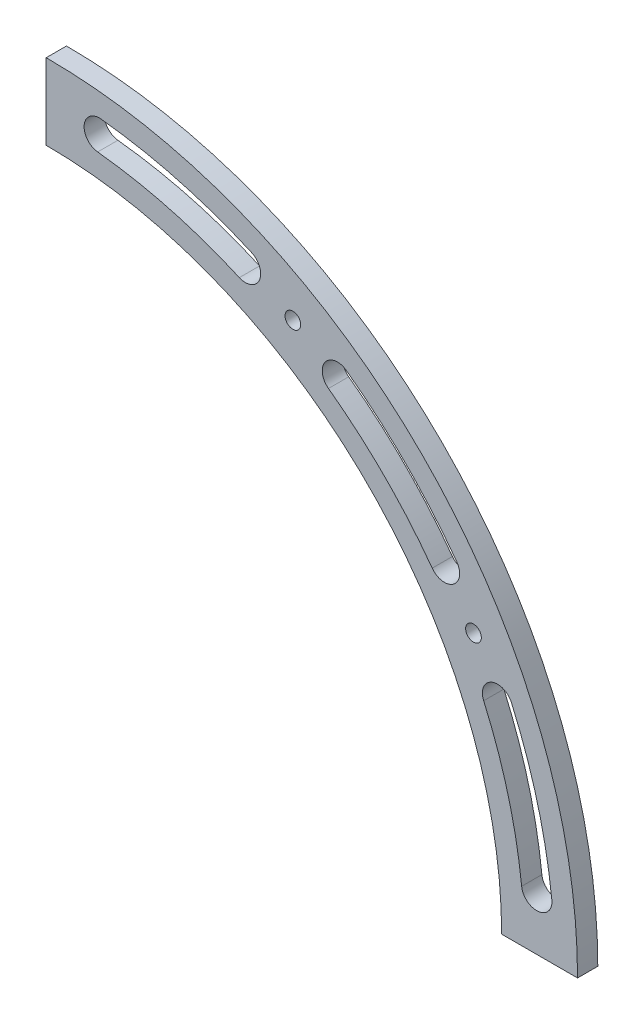
from build123d import *

# Parameters (mm, degrees)
EXTRUDE_1_DEPTH     = 15
SKETCH_2_W          = 15
SKETCH_2_H          = 15
EXTRUDE_2_DEPTH     = 5
EXTRUDE_3_DEPTH     = 15
SKETCH_4_R          = 1.55
CUT_EXTRUDE_1_DEPTH = 163.095650774
SKETCH_5_R          = 1.55
CUT_EXTRUDE_2_DEPTH = 157.68439616
CUT_EXTRUDE_3_DEPTH = 4
SKETCH_7_OUTSIDE_W  = 149.836
SKETCH_7_OUTSIDE_H  = 219.836
CUT_EXTRUDE_4_DEPTH = 163.095650774
CUT_EXTRUDE_START   = -11
CUT_EXTRUDE_5_DEPTH = 11


with BuildPart() as part:
    # 草图1 → 凸台-拉伸1 (new body)
    with BuildSketch(Plane.XY):
        with BuildLine():
            Line((90, 0), (105, 0))
            ThreePointArc((105, 0), (74.246212025, 74.246212025), (0, 105))
            Line((0, 105), (0, 90))
            ThreePointArc((0, 90), (63.639610307, 63.639610307), (90, 0))
        make_face()
    extrude(amount=EXTRUDE_1_DEPTH)

    # 草图2 → 凸台-拉伸2 (add)
    with BuildSketch(Plane.XZ):
        with Locations((97.5, 7.5)):
            Rectangle(SKETCH_2_W, SKETCH_2_H)
    extrude(amount=EXTRUDE_2_DEPTH)

    # 草图3 → 凸台-拉伸3 (add)
    with BuildSketch(Plane(origin=(105, 0, 0), x_dir=(0, 0, -1), z_dir=(1, 0, 0))):
        with BuildLine():
            Line((50, -55), (50, -70))
            ThreePointArc((50, -70), (4.038059223, -50.961940777), (-15, -5))
            Line((-15, -5), (0, -5))
            ThreePointArc((0, -5), (14.644660941, -40.355339059), (50, -55))
        make_face()
    extrude(amount=-EXTRUDE_3_DEPTH)

    # 草图4 → 切除-拉伸1 (cut, through all)
    with BuildSketch(Plane.XY.offset(15)):
        with Locations((84.437476869, 48.75)):
            Circle(SKETCH_4_R)
        with Locations((48.75, 84.437476869)):
            Circle(SKETCH_4_R)
        with BuildLine():
            ThreePointArc((40.593936087, 91.936838933), (26.011314033, 97.075545542), (10.813039575, 99.916606103))
            ThreePointArc((10.813039575, 99.916606103), (7.507677018, 97.256798147), (10.167484974, 93.951435589))
            ThreePointArc((10.167484974, 93.951435589), (24.458399762, 91.279990584), (38.170417515, 86.448072429))
            ThreePointArc((38.170417515, 86.448072429), (42.126560053, 87.980696395), (40.593936087, 91.936838933))
        make_face()
        with BuildLine():
            ThreePointArc((81.123799357, 59.322670016), (71.064231509, 71.064231509), (59.322670016, 81.123799357))
            ThreePointArc((59.322670016, 81.123799357), (55.130238094, 80.473019377), (55.781018075, 76.280587456))
            ThreePointArc((55.781018075, 76.280587456), (66.821590822, 66.821590822), (76.280587456, 55.781018075))
            ThreePointArc((76.280587456, 55.781018075), (80.473019377, 55.130238094), (81.123799357, 59.322670016))
        make_face()
        with BuildLine():
            ThreePointArc((99.916606103, 10.813039575), (97.075545542, 26.011314033), (91.936838933, 40.593936087))
            ThreePointArc((91.936838933, 40.593936087), (87.980696395, 42.126560053), (86.448072429, 38.170417515))
            ThreePointArc((86.448072429, 38.170417515), (91.279990584, 24.458399762), (93.951435589, 10.167484974))
            ThreePointArc((93.951435589, 10.167484974), (97.256798147, 7.507677018), (99.916606103, 10.813039575))
        make_face()
    extrude(amount=-CUT_EXTRUDE_1_DEPTH, mode=Mode.SUBTRACT)

    # 草图5 → 切除-拉伸2 (cut, through all)
    with BuildSketch(Plane(origin=(105, 0, 0), x_dir=(0, 0, -1), z_dir=(1, 0, 0))):
        with Locations((44.969401847, -62.5)):
            Circle(SKETCH_5_R)
        with Locations((9.341360082, -45.658639918)):
            Circle(SKETCH_5_R)
        with Locations((-7.28119514, -10.011455208)):
            Circle(SKETCH_5_R)
        with BuildLine():
            ThreePointArc((-8.432245014, -20.681924073), (-4.831621116, -30.568404835), (0.427426106, -39.681550102))
            ThreePointArc((0.427426106, -39.681550102), (4.605316552, -40.419947976), (5.343714426, -36.24205753))
            ThreePointArc((5.343714426, -36.24205753), (0.606225607, -28.032695265), (-2.637311624, -19.126691933))
            ThreePointArc((-2.637311624, -19.126691933), (-6.312394389, -17.006841308), (-8.432245014, -20.681924073))
        make_face()
        with BuildLine():
            ThreePointArc((15.318449898, -54.572573894), (24.431595165, -59.831621116), (34.318075927, -63.432245014))
            ThreePointArc((34.318075927, -63.432245014), (37.993158692, -61.312394389), (35.873308067, -57.637311624))
            ThreePointArc((35.873308067, -57.637311624), (26.967304735, -54.393774393), (18.75794247, -49.656285574))
            ThreePointArc((18.75794247, -49.656285574), (14.580052024, -50.394683448), (15.318449898, -54.572573894))
        make_face()
    extrude(amount=-CUT_EXTRUDE_2_DEPTH, mode=Mode.SUBTRACT)

    # 草图6 → 切除-拉伸3 (cut)
    with BuildSketch(Plane(origin=(105, 0, 0), x_dir=(0, 0, -1), z_dir=(1, 0, 0))):
        with BuildLine():
            Line((50, -55), (50, -70))
            ThreePointArc((50, -70), (4.038059223, -50.961940777), (-15, -5))
            Line((-15, -5), (0, -5))
            ThreePointArc((0, -5), (14.644660941, -40.355339059), (50, -55))
        make_face()
    extrude(amount=-CUT_EXTRUDE_3_DEPTH, mode=Mode.SUBTRACT)

    # 草图7 outside → 切除-拉伸4 (cut, through all)
    with BuildSketch(Plane.XY.offset(15)):
        with Locations((52.5, 17.5)):
            Rectangle(SKETCH_7_OUTSIDE_W, SKETCH_7_OUTSIDE_H)
        with BuildLine():
            Line((0, 105), (0, 90))
            ThreePointArc((0, 90), (63.639610307, 63.639610307), (90, 0))
            Line((90, 0), (105, 0))
            ThreePointArc((105, 0), (74.246212025, 74.246212025), (0, 105))
        make_face(mode=Mode.SUBTRACT)
    extrude(amount=-CUT_EXTRUDE_4_DEPTH, mode=Mode.SUBTRACT)

    # 草图8 → 切除-拉伸5 (cut)
    with BuildSketch(Plane.XY.offset(15).offset(CUT_EXTRUDE_START)):
        with BuildLine():
            Line((0, 105), (0, 90))
            ThreePointArc((0, 90), (63.639610307, 63.639610307), (90, 0))
            Line((90, 0), (105, 0))
            ThreePointArc((105, 0), (74.246212025, 74.246212025), (0, 105))
        make_face()
    extrude(amount=CUT_EXTRUDE_5_DEPTH, mode=Mode.SUBTRACT)


solid = part.part
